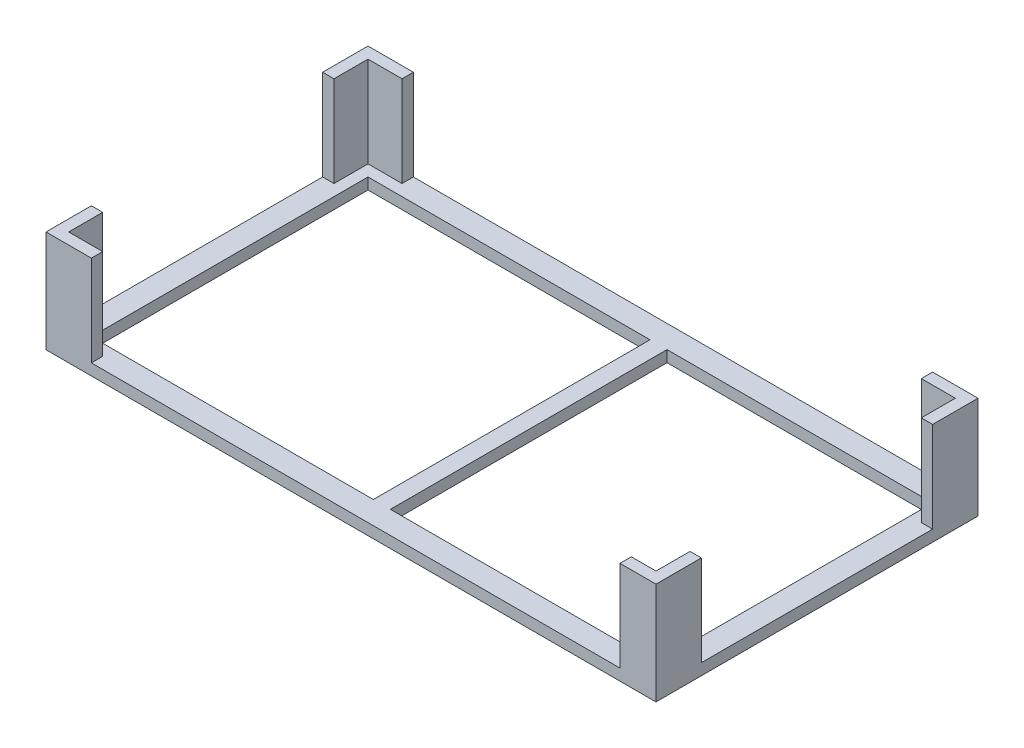
from build123d import *

# Parameters (mm, degrees)
SKETCH_1_W          = 53.8
SKETCH_1_H          = 28.4
EXTRUDE_1_DEPTH     = 1
EXTRUDE_2_DEPTH     = 8
SKETCH_4_W          = 23.427026947
SKETCH_4_H          = 24.4
SKETCH_4_W_2        = 24.872973053
CUT_EXTRUDE_1_DEPTH = 62.497967446


with BuildPart() as part:
    # 草图1 → 凸台-拉伸1 (new body)
    with BuildSketch(Plane(origin=(0, 0, 0), x_dir=(1, 0, 0), z_dir=(0, 1, 0))):
        with Locations((26.9, -14.2)):
            Rectangle(SKETCH_1_W, SKETCH_1_H)
    extrude(amount=EXTRUDE_1_DEPTH)

    # 草图2 → 凸台-拉伸2 (add)
    with BuildSketch(Plane(origin=(0, 1, 0), x_dir=(1, 0, 0), z_dir=(0, 1, 0))):
        Polygon((53.8, -28.4), (53.621994937, -28.4), (50.621994937, -28.4), (50.621994937, -27.4), (52.8, -27.4), (52.8, -24.4), (53.8, -24.4), align=None)
        Polygon((53.8, 0), (52.8, 0), (49.8, 0), (49.8, -1), (52.8, -1), (52.8, -4), (53.8, -4), align=None)
        Polygon((0, -27.4), (0, -24.4), (1, -24.4), (1, -27.4), (4, -27.4), (4, -28.4), (0, -28.4), align=None)
        Polygon((0, 0), (4, 0), (4, -1), (1, -1), (1, -4), (0, -4), (0, -1), align=None)
    extrude(amount=EXTRUDE_2_DEPTH)

    # 草图4 → 切除-拉伸1 (cut, through all)
    with BuildSketch(Plane.XZ):
        with Locations((40.086486527, 14.2)):
            Rectangle(SKETCH_4_W, SKETCH_4_H)
        with Locations((14.436486527, 14.2)):
            Rectangle(SKETCH_4_W_2, SKETCH_4_H)
    extrude(amount=-CUT_EXTRUDE_1_DEPTH, mode=Mode.SUBTRACT)


solid = part.part
